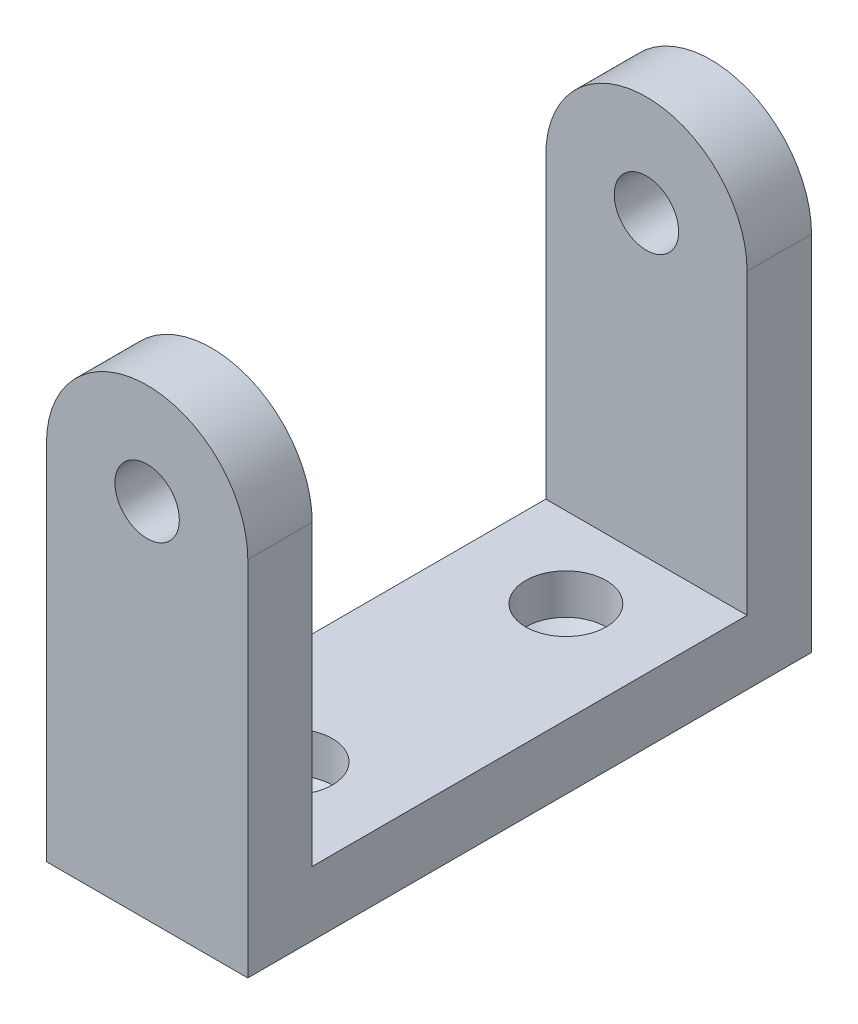
from build123d import *

# Parameters (mm, degrees)
SKETCH1_R           = 4
BOSS_EXTRUDE1_DEPTH = 70
SKETCH2_W           = 54
SKETCH2_H           = 49.5
CUT_EXTRUDE1_DEPTH  = 35
HOLE1_AT_2_COUNT    = 2
HOLE1_AT_2_PITCH    = 34


with BuildPart() as part:
    # Sketch1 → Boss-Extrude1 (new body)
    with BuildSketch(Plane.XY):
        with BuildLine():
            Line((-12.5, 22.5), (-12.5, -22.5))
            Line((-12.5, -22.5), (12.5, -22.5))
            Line((12.5, -22.5), (12.5, 22.5))
            ThreePointArc((12.5, 22.5), (0, 35), (-12.5, 22.5))
        make_face()
        with Locations((0, 22.5)):
            Circle(SKETCH1_R, mode=Mode.SUBTRACT)
    extrude(amount=-BOSS_EXTRUDE1_DEPTH)

    # Sketch2 → Cut-Extrude1 (cut, symmetric)
    with BuildSketch(Plane(origin=(12.5, 0, 0), x_dir=(0, 0, -1), z_dir=(1, 0, 0))):
        with Locations((35, 10.25)):
            Rectangle(SKETCH2_W, SKETCH2_H)
    extrude(amount=CUT_EXTRUDE1_DEPTH, both=True, mode=Mode.SUBTRACT)

    # Sketch5 → Hole1 (revolve, cut)
    with BuildSketch(Plane(origin=(0, -14.5, -52), x_dir=(0, 0, 1), z_dir=(1, 0, 0))):
        Polygon((0, 0), (0, 8), (3, 8), (3, 6.201721238), (5, 5), (5, 0), align=None)
    hole1 = revolve(axis=Axis((0, -8.369976101, -52), (0, -1, 0)), mode=Mode.SUBTRACT)

    # Hole1 at 2: Hole1 ×2
    with Locations(*[(0, 0, i * HOLE1_AT_2_PITCH) for i in range(1, HOLE1_AT_2_COUNT)]):
        add(hole1, mode=Mode.SUBTRACT)


solid = part.part
